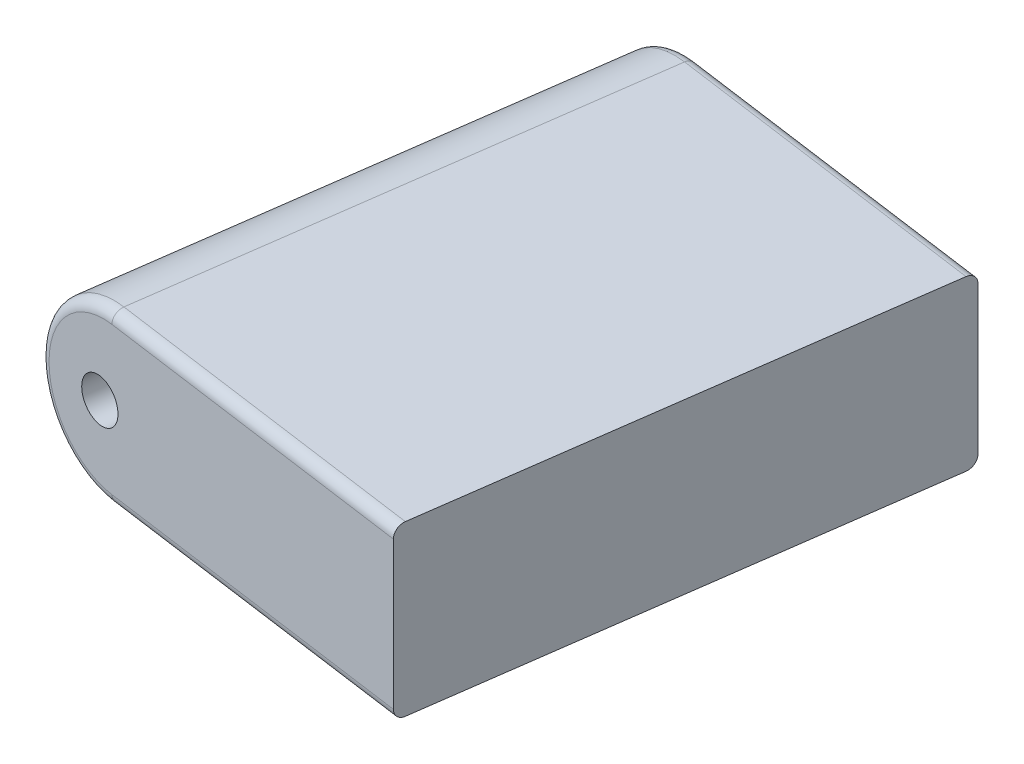
from build123d import *

# Parameters (mm, degrees)
BOSS_EXTRUDE1_DEPTH     = 7.9375
SKETCH3_R               = 2.032
CUT_EXTRUDE1_DEPTH      = 2.7
SKETCH4_R               = 1.000000032
CUT_EXTRUDE2_DEPTH      = 51.553064313
CUT_EXTRUDE3_DEPTH      = 52.939206859
CUT_EXTRUDE3_DEPTH_BACK = 52.939206859
CUT_EXTRUDE5_DEPTH      = 0.7
FILLET1_R               = 0.5
SKETCH6_R               = 2.032
CUT_EXTRUDE4_DEPTH      = 3.8
BOSS_EXTRUDE2_DEPTH     = 0.637


with BuildPart() as part:
    # Sketch1 → Boss-Extrude1 (new body)
    with BuildSketch(Plane(origin=(0, 0, 0), x_dir=(1, 0, 0), z_dir=(0, 1, 0))):
        Polygon((-27.620855991, -19.092445695), (-46.29298428, -16.509012872), (-42.852975587, 8.354139385), (-24.180847298, 5.770706562), align=None)
    extrude(amount=BOSS_EXTRUDE1_DEPTH)

    # Sketch3 → Cut-Extrude1 (cut)
    with BuildSketch(Plane(origin=(0.275554746, 0, -2.386974896), x_dir=(-0.9905638349724136, 0, -0.13705213914691383), z_dir=(0.13705213914691383, 0, -0.9905638349724136))):
        with Locations((40.237375061, 3.96875)):
            Circle(SKETCH3_R)
    extrude(amount=-CUT_EXTRUDE1_DEPTH, mode=Mode.SUBTRACT)

    # Sketch4 → Cut-Extrude2 (cut, through all)
    with BuildSketch(Plane(origin=(-0.040811883, 0, 0.29497369), x_dir=(-0.9905638349724136, 0, -0.13705213914691383), z_dir=(0.1370521391469138, 0, -0.9905638349724135))):
        with Locations((40.291560511, 3.96875)):
            Circle(SKETCH4_R)
    extrude(amount=-CUT_EXTRUDE2_DEPTH, mode=Mode.SUBTRACT)

    # Sketch5 → Cut-Extrude3 (cut, two sides: drawn at the far end of the back side and taken through both)
    with BuildSketch(Plane(origin=(0.329228893, 0, -2.379548664), x_dir=(-0.9905638349724137, 0, -0.1370521391469133), z_dir=(0.1370521391469133, 0, -0.9905638349724137)).offset(-CUT_EXTRUDE3_DEPTH_BACK)):
        with BuildLine():
            ThreePointArc((43.593560511, 3.96875), (42.431140549, 1.162419962), (39.624810511, 0))
            Line((39.624810511, 0), (43.593560511, 0))
            Line((43.593560511, 0), (43.593560511, 3.96875))
        make_face()
        with BuildLine():
            Line((43.593560511, 7.9375), (39.624810511, 7.9375))
            ThreePointArc((39.624810511, 7.9375), (42.431140549, 6.775080038), (43.593560511, 3.96875))
            Line((43.593560511, 3.96875), (43.593560511, 7.9375))
        make_face()
    extrude(amount=CUT_EXTRUDE3_DEPTH + CUT_EXTRUDE3_DEPTH_BACK, mode=Mode.SUBTRACT)

    # Sketch8 → Cut-Extrude5 (cut)
    with BuildSketch(Plane(origin=(-3.1107798, 0, 22.483603594), x_dir=(0.9905638349724136, 0, 0.1370521391469135), z_dir=(-0.1370521391469135, 0, 0.9905638349724137))):
        with BuildLine():
            Line((-39.624810511, 0), (-24.743560511, 0))
            Line((-24.743560511, 0), (-24.743560511, 7.9375))
            Line((-24.743560511, 7.9375), (-39.624810511, 7.9375))
            ThreePointArc((-39.624810511, 7.9375), (-43.593560511, 3.96875), (-39.624810511, 0))
        make_face()
    extrude(amount=-CUT_EXTRUDE5_DEPTH, mode=Mode.SUBTRACT)

    # Fillet1
    fillet1_edges = [part.edges().sort_by_distance(p)[0] for p in [
        (-42.852975587, 3.96875, -8.354139385),
        (-31.551261333, 0, -6.790460135),
        (-46.197047782, 3.96875, 15.815618188),
        (-34.895333528, 7.9375, 17.379297438),
        (-34.895333528, 0, 17.379297438),
        (-31.551261333, 7.9375, -6.790460135),
    ]]
    fillet(fillet1_edges, radius=FILLET1_R)

    # Sketch6 → Cut-Extrude4 (cut)
    # profile 1 of 4: a face of its own
    with BuildSketch(Plane(origin=(0.329228893, 0, -2.379548664), x_dir=(-0.9905638349724137, 0, -0.1370521391469133), z_dir=(0.1370521391469133, 0, -0.9905638349724137))):
        with BuildLine():
            Line((41.099755957, 7.039164487), (39.857545305, 7.366139557))
            Line((39.857545305, 7.366139557), (26.117003817, 5.610790678))
            ThreePointArc((26.117003817, 5.610790678), (25.770140702, 3.96875), (26.117003817, 2.326709322))
            Line((26.117003817, 2.326709322), (39.857545305, 0.571360443))
            Line((39.857545305, 0.571360443), (41.099755957, 0.898335513))
            ThreePointArc((41.099755957, 0.898335513), (40.498298253, 0.800487936), (39.889225247, 0.819345082))
            Line((39.889225247, 0.819345082), (26.291560511, 2.556441511))
            Line((26.291560511, 2.556441511), (26.291560511, 3.67018175))
            ThreePointArc((26.291560511, 3.67018175), (27.210560511, 3.96875), (26.291560511, 4.26731825))
            Line((26.291560511, 4.26731825), (26.291560511, 5.381058489))
            Line((26.291560511, 5.381058489), (39.889225247, 7.118154918))
            ThreePointArc((39.889225247, 7.118154918), (40.498298253, 7.137012064), (41.099755957, 7.039164487))
        make_face()
    # profile 2 of 4: a face of its own
    with BuildSketch(Plane(origin=(0.329228893, 0, -2.379548664), x_dir=(-0.9905638349724137, 0, -0.1370521391469133), z_dir=(0.1370521391469133, 0, -0.9905638349724137))):
        with BuildLine():
            ThreePointArc((39.889225247, 0.819345082), (37.116560511, 3.96875), (39.889225247, 7.118154918))
            Line((39.889225247, 7.118154918), (26.291560511, 5.381058489))
            Line((26.291560511, 5.381058489), (26.291560511, 4.26731825))
            ThreePointArc((26.291560511, 4.26731825), (27.210560511, 3.96875), (26.291560511, 3.67018175))
            Line((26.291560511, 3.67018175), (26.291560511, 2.556441511))
            Line((26.291560511, 2.556441511), (39.889225247, 0.819345082))
        make_face()
    # profile 3 of 4: a face of its own
    with BuildSketch(Plane(origin=(0.329228893, 0, -2.379548664), x_dir=(-0.9905638349724137, 0, -0.1370521391469133), z_dir=(0.1370521391469133, 0, -0.9905638349724137))):
        with BuildLine():
            ThreePointArc((41.421703743, 6.935802624), (41.262106814, 6.991772473), (41.099755957, 7.039164487))
            ThreePointArc((41.099755957, 7.039164487), (40.498298253, 7.137012064), (39.889225247, 7.118154918))
            ThreePointArc((39.889225247, 7.118154918), (37.116560511, 3.96875), (39.889225247, 0.819345082))
            ThreePointArc((39.889225247, 0.819345082), (40.498298253, 0.800487936), (41.099755957, 0.898335513))
            ThreePointArc((41.099755957, 0.898335513), (41.262106814, 0.945727527), (41.421703743, 1.001697376))
            ThreePointArc((41.421703743, 1.001697376), (43.093560511, 3.96875), (41.421703743, 6.935802624))
        make_face()
        with Locations((40.291560511, 3.96875)):
            Circle(SKETCH6_R, mode=Mode.SUBTRACT)
    # profile 4 of 4: a face of its own
    with BuildSketch(Plane(origin=(0.329228893, 0, -2.379548664), x_dir=(-0.9905638349724137, 0, -0.1370521391469133), z_dir=(0.1370521391469133, 0, -0.9905638349724137))):
        with Locations((40.291560511, 3.96875)):
            Circle(SKETCH6_R)
    extrude(amount=-CUT_EXTRUDE4_DEPTH, mode=Mode.SUBTRACT)

    # Sketch7 → Boss-Extrude2 (add)
    with BuildSketch(Plane(origin=(-24.510076191, 0, -3.391157898), x_dir=(0.13705213914691317, 0, -0.9905638349724137), z_dir=(0.9905638349724137, 0, 0.13705213914691317))):
        with BuildLine():
            Line((-21.497783626, 0), (1.902216374, 0))
            ThreePointArc((1.902216374, 0), (2.255769765, 0.146446609), (2.402216374, 0.5))
            Line((2.402216374, 0.5), (2.402216374, 7.4375))
            ThreePointArc((2.402216374, 7.4375), (2.255769765, 7.791053391), (1.902216374, 7.9375))
            Line((1.902216374, 7.9375), (-21.497783626, 7.9375))
            ThreePointArc((-21.497783626, 7.9375), (-21.851337016, 7.791053391), (-21.997783626, 7.4375))
            Line((-21.997783626, 7.4375), (-21.997783626, 0.5))
            ThreePointArc((-21.997783626, 0.5), (-21.851337016, 0.146446609), (-21.497783626, 0))
        make_face()
    extrude(amount=BOSS_EXTRUDE2_DEPTH)


solid = part.part
